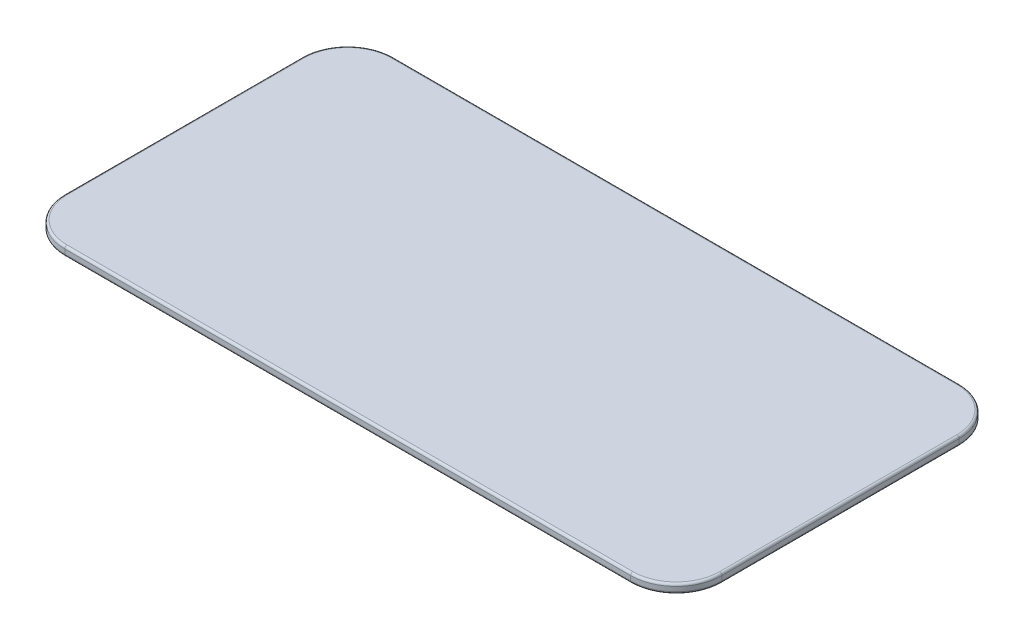
from build123d import *

# Parameters (mm, degrees)
SKETCH1_W           = 1828.8
SKETCH1_H           = 914.4
BOSS_EXTRUDE1_DEPTH = 25.4
FILLET1_R           = 127
FILLET2_R           = 6.35


with BuildPart() as part:
    # Sketch1 → Boss-Extrude1 (new body)
    with BuildSketch(Plane(origin=(0, 0, 0), x_dir=(1, 0, 0), z_dir=(0, 1, 0))):
        Rectangle(SKETCH1_W, SKETCH1_H)
    extrude(amount=BOSS_EXTRUDE1_DEPTH)

    # Fillet1
    fillet1_edges = [part.edges().sort_by_distance(p)[0] for p in [
        (914.4, 12.7, 457.2),
        (-914.4, 12.7, 457.2),
        (-914.4, 12.7, -457.2),
        (914.4, 12.7, -457.2),
    ]]
    fillet(fillet1_edges, radius=FILLET1_R)

    # Fillet2
    fillet2_edges = [part.edges().sort_by_distance(p)[0] for p in [
        (-914.4, 0, 0),
        (-914.4, 25.4, 0),
        (914.4, 0, 0),
        (0, 0, 457.2),
        (0, 0, -457.2),
        (877.202561211, 0, 420.002561211),
        (877.202561211, 0, -420.002561211),
        (-877.202561211, 0, 420.002561211),
        (-877.202561211, 0, -420.002561211),
        (0, 25.4, -457.2),
        (914.4, 25.4, 0),
        (0, 25.4, 457.2),
        (877.202561211, 25.4, 420.002561211),
        (877.202561211, 25.4, -420.002561211),
        (-877.202561211, 25.4, 420.002561211),
        (-877.202561211, 25.4, -420.002561211),
    ]]
    fillet(fillet2_edges, radius=FILLET2_R)


solid = part.part
